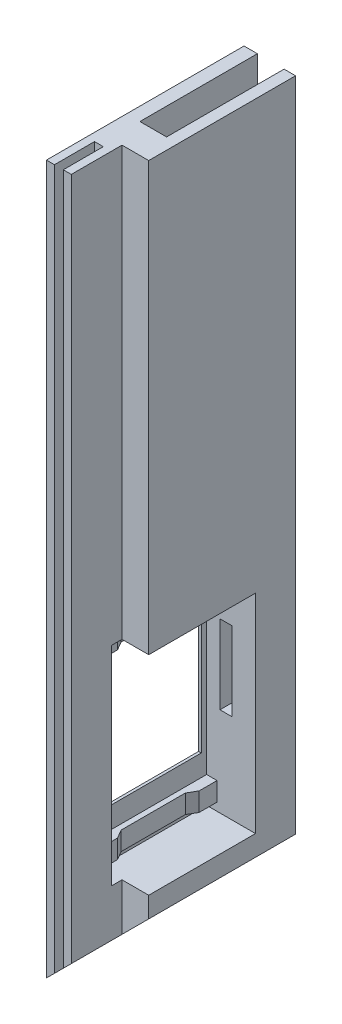
from build123d import *

# Parameters (mm, degrees)
BOSS_EXTRUDE1_DEPTH = 265.3
SKETCH2_W           = 10
SKETCH2_H           = 44
CUT_EXTRUDE1_DEPTH  = 10
SKETCH3_W           = 271.149403365
SKETCH3_H           = 159.03985052
CUT_EXTRUDE2_DEPTH  = 31
SKETCH4_W           = 28
SKETCH4_H           = 7
CUT_EXTRUDE3_DEPTH  = 8
SKETCH5_W           = 28.4
SKETCH5_H           = 7.4
CUT_EXTRUDE4_DEPTH  = 8
SKETCH6_W           = 44
SKETCH6_H           = 78
CUT_EXTRUDE5_DEPTH  = 18.3
SKETCH7_W           = 40
SKETCH7_H           = 51
CUT_EXTRUDE6_DEPTH  = 18.3
SKETCH8_W           = 3.9
SKETCH8_H           = 7
BOSS_EXTRUDE2_DEPTH = 44
CUT_EXTRUDE7_DEPTH  = 7
LPATTERN1_COUNT     = 2
LPATTERN1_PITCH     = 68
SKETCH11_W          = 4.5
SKETCH11_H          = 29.5
CUT_EXTRUDE8_DEPTH  = 15


with BuildPart() as part:
    # Sketch1 → Boss-Extrude1 (new body)
    with BuildSketch(Plane(origin=(0, 0, 0), x_dir=(1, 0, 0), z_dir=(0, 1, 0))):
        Polygon((-51.505795374, 37), (-32.205795374, 37), (-32.205795374, -18), (-42.205795374, -18), (-42.205795374, -37), (-45.205795374, -37), (-45.205795374, -22), (-48.505795374, -22), (-48.505795374, -37), (-51.505795374, -37), align=None)
    extrude(amount=BOSS_EXTRUDE1_DEPTH)

    # Sketch2 → Cut-Extrude1 (cut)
    with BuildSketch(Plane(origin=(0, 265.3, 0), x_dir=(1, 0, 0), z_dir=(0, 1, 0))):
        with Locations((-41.505795374, 15)):
            Rectangle(SKETCH2_W, SKETCH2_H)
    extrude(amount=-CUT_EXTRUDE1_DEPTH, mode=Mode.SUBTRACT)

    # Sketch3 → Cut-Extrude2 (cut)
    with BuildSketch(Plane(origin=(-25.752897687, 25.752897687, 0), x_dir=(0, 0, 1), z_dir=(0.7071067811865488, -0.7071067811865464, 0))):
        with Locations((3.075588753, 19.523863597)):
            Rectangle(SKETCH3_W, SKETCH3_H)
    extrude(amount=CUT_EXTRUDE2_DEPTH, mode=Mode.SUBTRACT)

    # Sketch4 → Cut-Extrude3 (cut)
    with BuildSketch(Plane(origin=(-25.752897687, 25.752897687, 0), x_dir=(0, 0, -1), z_dir=(0.7071067811865487, -0.7071067811865465, 0))):
        with Locations((11, -18.625775426)):
            Rectangle(SKETCH4_W, SKETCH4_H)
    extrude(amount=-CUT_EXTRUDE3_DEPTH, mode=Mode.SUBTRACT)

    # Sketch5 → Cut-Extrude4 (cut)
    with BuildSketch(Plane(origin=(-25.752897687, 25.752897687, 0), x_dir=(0, 0, -1), z_dir=(0.7071067811865487, -0.7071067811865465, 0))):
        with Locations((11, -18.625775426)):
            Rectangle(SKETCH5_W, SKETCH5_H)
    extrude(amount=-CUT_EXTRUDE4_DEPTH, mode=Mode.SUBTRACT)

    # Sketch6 → Cut-Extrude5 (cut)
    with BuildSketch(Plane(origin=(-32.205795374, 0, 0), x_dir=(0, 0, -1), z_dir=(1, 0, 0))):
        with Locations((0, 66)):
            Rectangle(SKETCH6_W, SKETCH6_H)
    extrude(amount=-CUT_EXTRUDE5_DEPTH, mode=Mode.SUBTRACT)

    # Sketch7 → Cut-Extrude6 (cut)
    with BuildSketch(Plane(origin=(-50.505795374, 0, 0), x_dir=(0, 0, -1), z_dir=(1, 0, 0))):
        with Locations((0, 70.5)):
            Rectangle(SKETCH7_W, SKETCH7_H)
    extrude(amount=-CUT_EXTRUDE6_DEPTH, mode=Mode.SUBTRACT)

    # Sketch8 → Boss-Extrude2 (add)
    with BuildSketch(Plane.XY.offset(-22)):
        with Locations((-48.555795374, 33.5)):
            Rectangle(SKETCH8_W, SKETCH8_H)
    boss_extrude2 = extrude(amount=BOSS_EXTRUDE2_DEPTH)

    # Sketch10 → Cut-Extrude7 (cut)
    with BuildSketch(Plane(origin=(0, 37, 0), x_dir=(1, 0, 0), z_dir=(0, 1, 0))):
        Polygon((-46.605795374, -15.29), (-48.505795374, -12.001413069), (-48.505795374, 11.998586931), (-46.605795374, 15.287173861), align=None)
    cut_extrude7 = extrude(amount=-CUT_EXTRUDE7_DEPTH, mode=Mode.SUBTRACT)

    # LPattern1: Boss-Extrude2, Cut-Extrude7 ×2
    with Locations(*[(0, i * LPATTERN1_PITCH, 0) for i in range(1, LPATTERN1_COUNT)]):
        add(boss_extrude2)
        add(cut_extrude7, mode=Mode.SUBTRACT)

    # Sketch11 → Cut-Extrude8 (cut)
    with BuildSketch(Plane.XY.offset(-22)):
        with Locations((-43.255795374, 75.25)):
            Rectangle(SKETCH11_W, SKETCH11_H)
    extrude(amount=-CUT_EXTRUDE8_DEPTH, mode=Mode.SUBTRACT)


solid = part.part
